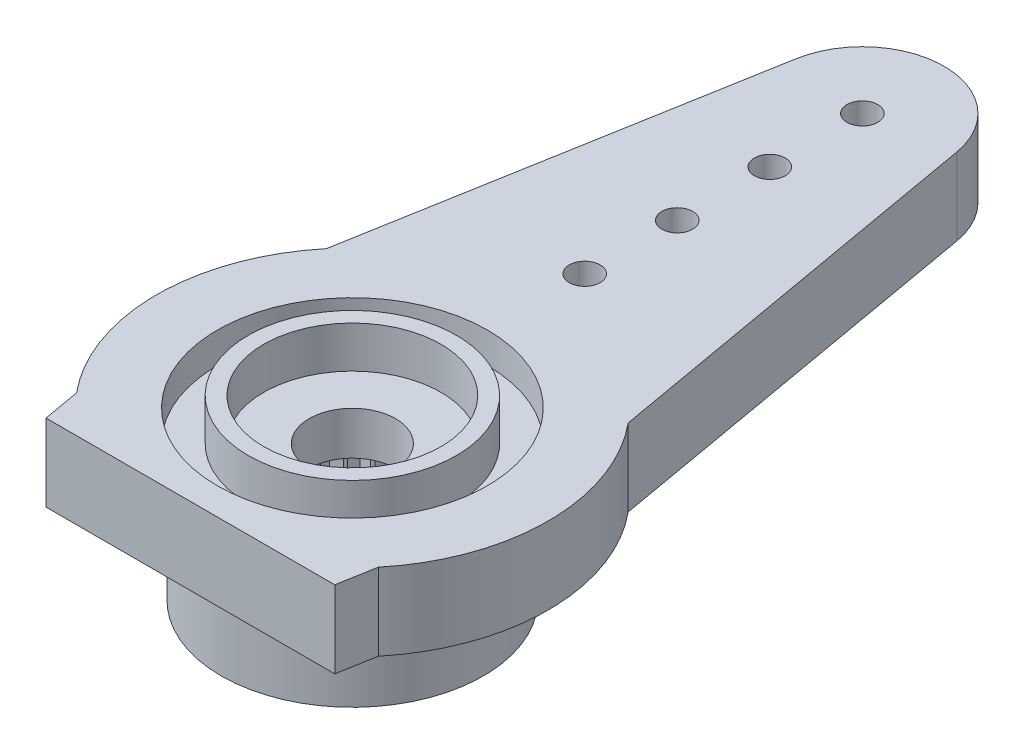
from build123d import *

# Parameters (mm, degrees)
BASES_R                     = 6.35
BASE_DEPTH                  = 5.4
TOPBORES_R                  = 1.4
TOP_BORE_DEPTH              = 11.478788098
HORN_START                  = -2.5
HORN_HALF_DEPTH             = 2.5
HORNATTACHS_R               = 0.5
HORN_ATTACH_DEPTH           = 21.913031822
HA_LP_COUNT                 = 4
HA_LP_PITCH                 = 3
HORN_BODIES_COPY_1_SKETCH_R = 0.5
HORN_BODIES_COPY_1_DEPTH    = 21.913031822
HORN_BODIES_COPY_2_SKETCH_R = 0.5
HORN_BODIES_COPY_2_DEPTH    = 21.913031822
HORN_BODIES_COPY_3_SKETCH_R = 0.5
HORN_BODIES_COPY_3_DEPTH    = 21.913031822
TOOTH_DEPTH                 = 3
TOOTH_CP_COUNT              = 26
BOTTOMBORES_R               = 2.6
BOTTOM_BORE_DEPTH           = 3
HOLDINGSHAFTS_R             = 6.35
HOLDINGSHAFTS_R_2           = 4.25
HOLDING_SHAFT_DEPTH         = 2.9
TOPCUTS_R                   = 4.375
TOP_CUT_DEPTH               = 1
TOPPOCKETCYLINDERS_R        = 3.375
TOPPOCKETCYLINDERS_R_2      = 2.875
TOP_POCKET_CYLINDER_DEPTH   = 1.35
CUT_EXTRUDE1_START          = -2.5
CUT_EXTRUDE1_DEPTH          = 2.5


with BuildPart() as part:
    # BaseS → BASE (new body)
    with BuildSketch(Plane(origin=(0, 0, 0), x_dir=(1, 0, 0), z_dir=(0, 1, 0))):
        with Locations(Location((0, 0, 0), (0, 0, 90))):
            Circle(BASES_R)
    extrude(amount=BASE_DEPTH)

    # TopBoreS → TOP BORE (cut, through all)
    with BuildSketch(Plane(origin=(0, 5.4, 0), x_dir=(1, 0, 0), z_dir=(0, 1, 0))):
        with Locations(Location((0, 0, 0), (0, 0, 270))):
            Circle(TOPBORES_R)
    extrude(amount=-TOP_BORE_DEPTH, mode=Mode.SUBTRACT)

    # HornHalfS → HORN HALF (add)
    with BuildSketch(Plane(origin=(0, 5.4, 0), x_dir=(1, 0, 0), z_dir=(0, 1, 0)).offset(HORN_START)):
        with BuildLine():
            Line((-2.609740545, 16.990167671), (-4.891612682, 4.049027706))
            ThreePointArc((-4.891612682, 4.049027706), (0, 6.35), (4.891612682, 4.049027706))
            Line((4.891612682, 4.049027706), (2.609740545, 16.990167671))
            ThreePointArc((2.609740545, 16.990167671), (0, 19.18), (-2.609740545, 16.990167671))
        make_face()
    horn_half = extrude(amount=HORN_HALF_DEPTH)

    # HornAttachS → HORN ATTACH (cut, through all)
    with BuildSketch(Plane(origin=(0, 5.4, 0), x_dir=(1, 0, 0), z_dir=(0, 1, 0))):
        with Locations(Location((0, 16.53, 0), (0, 0, 270))):
            Circle(HORNATTACHS_R)
    horn_attach = extrude(amount=-HORN_ATTACH_DEPTH, mode=Mode.SUBTRACT)

    # HA LP: HORN ATTACH ×4
    with Locations(*[(0, 0, i * HA_LP_PITCH) for i in range(1, HA_LP_COUNT)]):
        add(horn_attach, mode=Mode.SUBTRACT)

    # HORN BODIES: HORN HALF, HORN ATTACH across plane
    add(horn_half.mirror(Plane.XY))
    add(horn_attach.mirror(Plane.XY), mode=Mode.SUBTRACT)

    # HORN BODIES copy 1 sketch → HORN BODIES copy 1 (cut, through all)
    with BuildSketch(Plane(origin=(0, 5.4, -3), x_dir=(1, 0, 0), z_dir=(0, 1, 0))):
        with Locations((0, -16.53)):
            Circle(HORN_BODIES_COPY_1_SKETCH_R)
    extrude(amount=-HORN_BODIES_COPY_1_DEPTH, mode=Mode.SUBTRACT)

    # HORN BODIES copy 2 sketch → HORN BODIES copy 2 (cut, through all)
    with BuildSketch(Plane(origin=(0, 5.4, -6), x_dir=(1, 0, 0), z_dir=(0, 1, 0))):
        with Locations((0, -16.53)):
            Circle(HORN_BODIES_COPY_2_SKETCH_R)
    extrude(amount=-HORN_BODIES_COPY_2_DEPTH, mode=Mode.SUBTRACT)

    # HORN BODIES copy 3 sketch → HORN BODIES copy 3 (cut, through all)
    with BuildSketch(Plane(origin=(0, 5.4, -9), x_dir=(1, 0, 0), z_dir=(0, 1, 0))):
        with Locations((0, -16.53)):
            Circle(HORN_BODIES_COPY_3_SKETCH_R)
    extrude(amount=-HORN_BODIES_COPY_3_DEPTH, mode=Mode.SUBTRACT)

    # ToothS → TOOTH (cut)
    with BuildSketch(Plane.XZ):
        with BuildLine():
            Line((0, -2.9), (0.262912611, -2.586672952))
            ThreePointArc((0.262912611, -2.586672952), (0, -2.6), (-0.262912611, -2.586672952))
            Line((-0.262912611, -2.586672952), (0, -2.9))
        make_face()
    tooth = extrude(amount=-TOOTH_DEPTH, mode=Mode.SUBTRACT)

    # TOOTH CP: TOOTH ×26 about axis
    tooth_cp_axis = Axis((0, 0, 0), (0, 1, 0))
    for i in range(1, TOOTH_CP_COUNT):
        add(tooth.rotate(tooth_cp_axis, i * 360 / TOOTH_CP_COUNT), mode=Mode.SUBTRACT)

    # BottomBoreS → BOTTOM BORE (cut)
    with BuildSketch(Plane(origin=(0, 0, 0), x_dir=(-1, 0, 0), z_dir=(0, -1, 0))):
        Circle(BOTTOMBORES_R)
    extrude(amount=-BOTTOM_BORE_DEPTH, mode=Mode.SUBTRACT)

    # HoldingShaftS → HOLDING SHAFT (cut)
    with BuildSketch(Plane.XZ):
        Circle(HOLDINGSHAFTS_R)
        with Locations(Location((0, 0, 0), (0, 0, 270))):
            Circle(HOLDINGSHAFTS_R_2, mode=Mode.SUBTRACT)
    extrude(amount=-HOLDING_SHAFT_DEPTH, mode=Mode.SUBTRACT)

    # TopCutS → TOP CUT (cut)
    with BuildSketch(Plane(origin=(0, 5.4, 0), x_dir=(1, 0, 0), z_dir=(0, 1, 0))):
        with Locations(Location((0, 0, 0), (0, 0, 270))):
            Circle(TOPCUTS_R)
    extrude(amount=-TOP_CUT_DEPTH, mode=Mode.SUBTRACT)

    # TopPocketCylinderS → TOP POCKET CYLINDER (add)
    with BuildSketch(Plane(origin=(0, 4.4, 0), x_dir=(1, 0, 0), z_dir=(0, 1, 0))):
        with Locations(Location((0, 0, 0), (0, 0, 270))):
            Circle(TOPPOCKETCYLINDERS_R)
        with Locations(Location((0, 0, 0), (0, 0, 270))):
            Circle(TOPPOCKETCYLINDERS_R_2, mode=Mode.SUBTRACT)
    extrude(amount=TOP_POCKET_CYLINDER_DEPTH)

    # Sketch1 → Cut-Extrude1 (cut)
    with BuildSketch(Plane(origin=(0, 5.4, 0), x_dir=(1, 0, 0), z_dir=(0, 1, 0)).offset(CUT_EXTRUDE1_START)):
        with BuildLine():
            Line((4.679848864, -5.25), (2.609740545, -16.990167671))
            ThreePointArc((2.609740545, -16.990167671), (0, -19.18), (-2.609740545, -16.990167671))
            Line((-2.609740545, -16.990167671), (-4.679848864, -5.25))
            Line((-4.679848864, -5.25), (4.679848864, -5.25))
        make_face()
    extrude(amount=CUT_EXTRUDE1_DEPTH, mode=Mode.SUBTRACT)


solid = part.part
